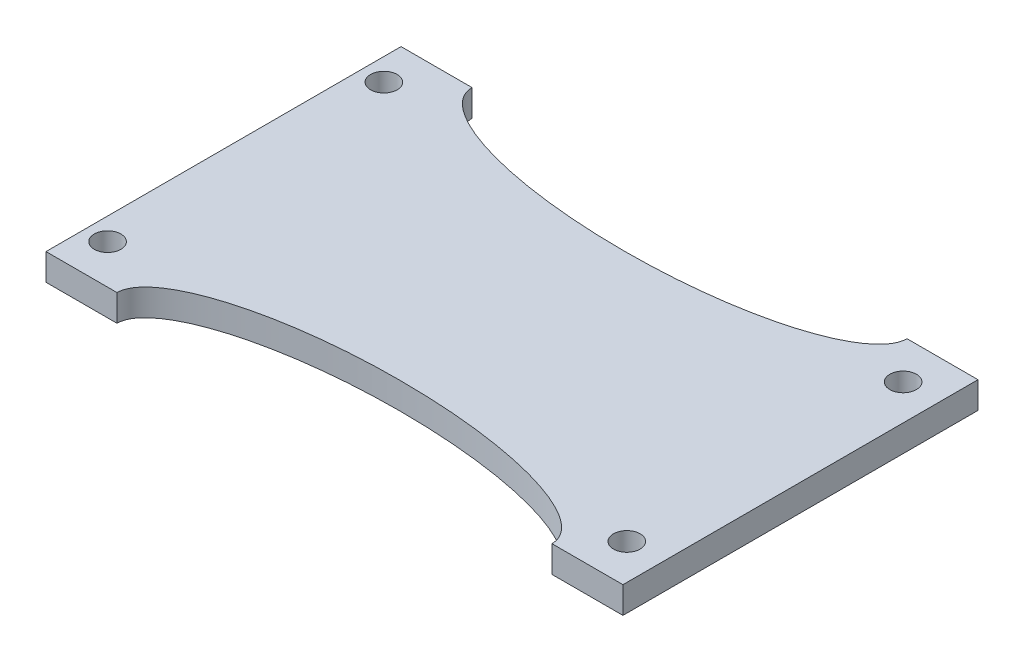
from build123d import *

# Parameters (mm, degrees)
BOSS_EXTRU_1_DEPTH      = 3
ESQUISSE3_R             = 1.5
ENL_V_MAT_EXTRU_1_DEPTH = 176.392221555


with BuildPart() as part:
    # Esquisse2 → Boss.-Extru.1 (new body)
    with BuildSketch(Plane.XZ.offset(44.978494119)):
        with BuildLine():
            Line((-80.367347697, 58.090598716), (-88.367347697, 58.090598716))
            add(Edge.make_bspline(
                [(-88.367347697, 58.090598716), (-88.367347697, 65.471186014), (-112.867347697, 65.471186014), (-137.367347697, 65.471186014), (-137.367347697, 58.090598716)],
                knots=[0, 0, 0, 1.570796327, 1.570796327, 3.141592654, 3.141592654, 3.141592654], degree=2, weights=[1, 0.707106781, 1, 0.707106781, 1]))
            Line((-137.367347697, 58.090598716), (-145.367347697, 58.090598716))
            Line((-145.367347697, 58.090598716), (-145.367347697, 98.090598716))
            Line((-145.367347697, 98.090598716), (-137.367347697, 98.090598716))
            add(Edge.make_bspline(
                [(-137.367347697, 98.090598716), (-137.367347697, 90.710011419), (-112.867347697, 90.710011419), (-88.367347697, 90.710011419), (-88.367347697, 98.090598716)],
                knots=[3.141592654, 3.141592654, 3.141592654, 4.71238898, 4.71238898, 6.283185307, 6.283185307, 6.283185307], degree=2, weights=[1, 0.707106781, 1, 0.707106781, 1]))
            Line((-88.367347697, 98.090598716), (-80.367347697, 98.090598716))
            Line((-80.367347697, 98.090598716), (-80.367347697, 58.090598716))
        make_face()
    extrude(amount=BOSS_EXTRU_1_DEPTH)

    # Esquisse3 → Enlèv. mat.-Extru.1 (cut, through all)
    with BuildSketch(Plane.XZ.offset(47.978494119)):
        with Locations(Location((-84.367347697, 93.655073862, 0), (0, 0, 270))):
            Circle(ESQUISSE3_R)
        with Locations(Location((-84.367347697, 62.526123571, 0), (0, 0, 90))):
            Circle(ESQUISSE3_R)
        with Locations(Location((-142.867347697, 93.655073862, 0), (0, 0, 270))):
            Circle(ESQUISSE3_R)
        with Locations(Location((-142.867347697, 62.526123571, 0), (0, 0, 90))):
            Circle(ESQUISSE3_R)
    extrude(amount=-ENL_V_MAT_EXTRU_1_DEPTH, mode=Mode.SUBTRACT)


solid = part.part
